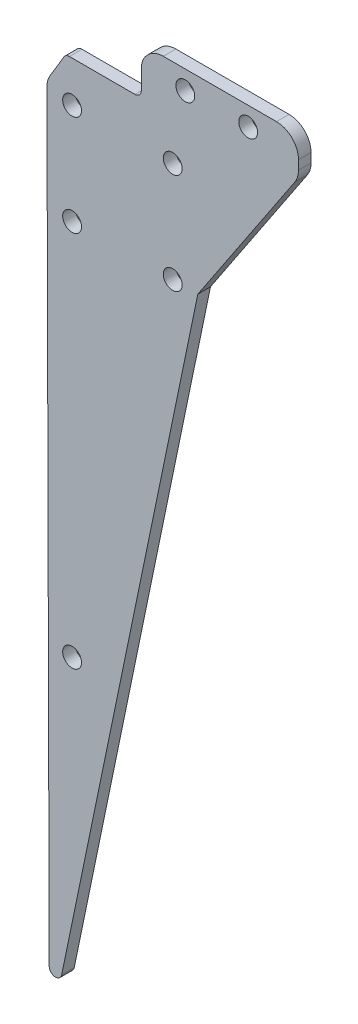
from build123d import *

# Parameters (mm, degrees)
EXTRUDE_1_DEPTH     = 2
SKETCH_2_R          = 1.5
CUT_EXTRUDE_1_DEPTH = 5
SKETCH_3_R          = 1.5
CUT_EXTRUDE_2_DEPTH = 10
FILLET_1_R          = 3.5
FILLET_2_R          = 1
SKETCH_4_R          = 1.5
EXTRUDE_2_DEPTH     = 2


with BuildPart() as part:
    # 草图1 → 凸台-拉伸1 (new body)
    with BuildSketch(Plane.XY):
        Polygon((5, -36), (-15, -16), (-15, -12.5), (-12, -7.5), (0, -7.5), (0, 0), (25, 0), (25, -6), align=None)
    extrude(amount=EXTRUDE_1_DEPTH)

    # 草图2 → 切除-拉伸1 (cut)
    with BuildSketch(Plane.XY.offset(2)):
        with Locations((17, -3)):
            Circle(SKETCH_2_R)
        with Locations((7, -3)):
            Circle(SKETCH_2_R)
    extrude(amount=-CUT_EXTRUDE_1_DEPTH, mode=Mode.SUBTRACT)

    # 草图3 → 切除-拉伸2 (cut)
    with BuildSketch(Plane.XY.offset(2)):
        with Locations((5, -30)):
            Circle(SKETCH_3_R)
        with Locations((5, -14)):
            Circle(SKETCH_3_R)
        with Locations((-11, -14)):
            Circle(SKETCH_3_R)
    extrude(amount=-CUT_EXTRUDE_2_DEPTH, mode=Mode.SUBTRACT)

    # 圆角1
    fillet_1_edges = [part.edges().sort_by_distance(p)[0] for p in [
        (25, 0, 1),
        (25, -6, 1),
        (5, -36, 1),
        (-15, -16, 1),
        (-15, -12.5, 1),
        (0, 0, 1),
    ]]
    fillet(fillet_1_edges, radius=FILLET_1_R)

    # 圆角2
    fillet_2_edges = [part.edges().sort_by_distance(p)[0] for p in [
        (-12, -7.5, 1),
        (0, -7.5, 1),
    ]]
    fillet(fillet_2_edges, radius=FILLET_2_R)

    # 草图4 → 凸台-拉伸2 (add)
    with BuildSketch(Plane.XY.offset(2)):
        with BuildLine():
            Line((9, -30), (-12.660289895, -134.591804029))
            ThreePointArc((-12.660289895, -134.591804029), (-13.739948562, -135.383956892), (-14.639507537, -134.392007979))
            Line((-14.639507537, -134.392007979), (-15, -14.009848205))
            Line((-15, -14.009848205), (9, -30))
        make_face()
        with Locations((-11, -30)):
            Circle(SKETCH_4_R, mode=Mode.SUBTRACT)
        with Locations((-11, -90)):
            Circle(SKETCH_4_R, mode=Mode.SUBTRACT)
        with Locations((5, -30)):
            Circle(SKETCH_4_R, mode=Mode.SUBTRACT)
    extrude(amount=-EXTRUDE_2_DEPTH)


solid = part.part
